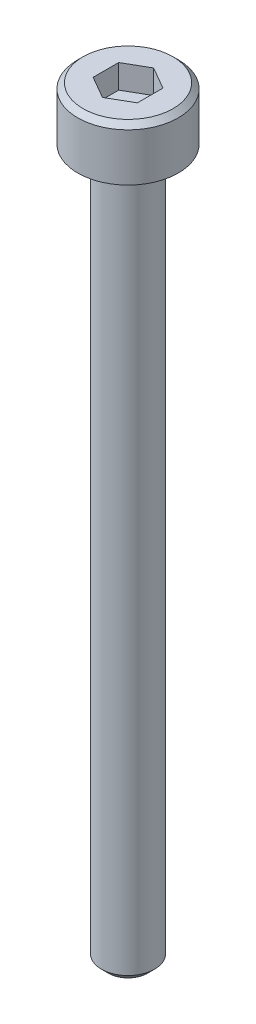
from build123d import *

# Parameters (mm, degrees)
CUT_EXTRUDE1_DEPTH = 1.35


with BuildPart() as part:
    # Sketch1 → Revolve1 (revolve)
    with BuildSketch(Plane.XY, mode=Mode.PRIVATE) as revolve1_sk:
        Polygon((0, -40), (1.1, -40), (1.5, -39.6), (1.5, 0), (2.84, 0), (2.84, 2.7), (2.54, 3), (0, 3), align=None)
    revolve(revolve1_sk.sketch.rotate(Axis((0, -10, 0), (0, 1, 0)), 90), axis=Axis((0, -10, 0), (0, 1, 0)))

    # Sketch2 → Cut-Extrude1 (cut)
    with BuildSketch(Plane(origin=(0, 3, 0), x_dir=(1, 0, 0), z_dir=(0, 1, 0))):
        Polygon((1.25, -0.721687836), (0, -1.443375673), (-1.25, -0.721687836), (-1.25, 0.721687836), (0, 1.443375673), (1.25, 0.721687836), align=None)
    extrude(amount=-CUT_EXTRUDE1_DEPTH, mode=Mode.SUBTRACT)


solid = part.part
